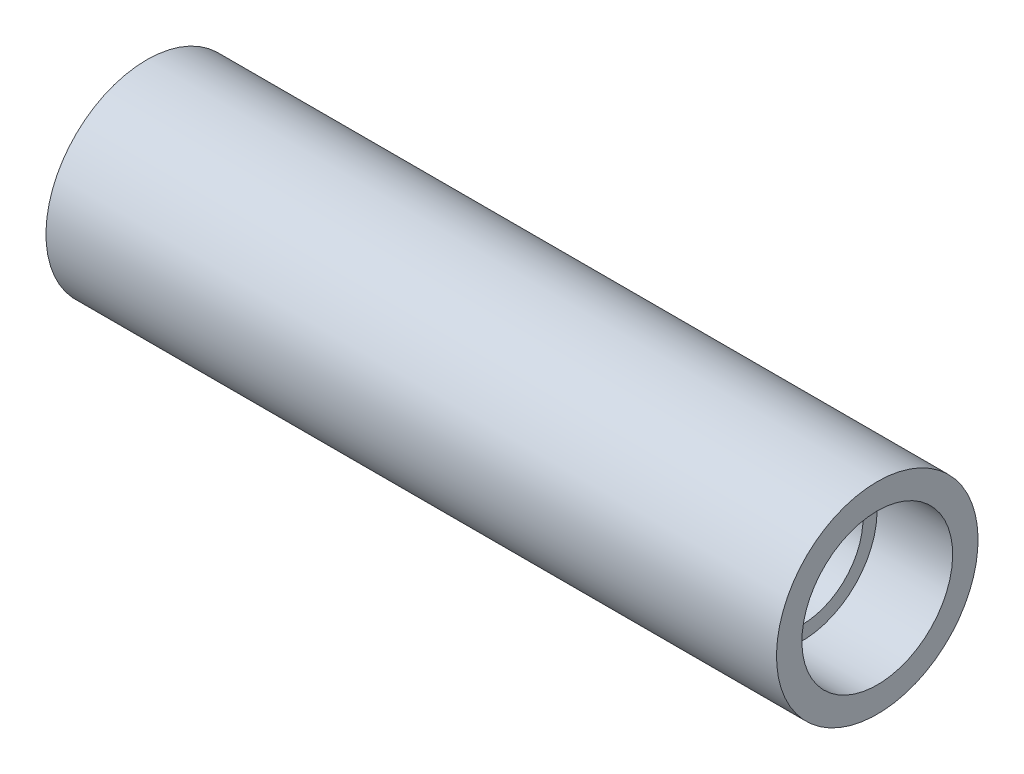
from build123d import *

# Parameters (mm, degrees)
F_24_0_152_DIAMETER_HOLE1_D = 3.8608


with BuildPart() as part:
    # Sketch1 → Revolve1 (revolve)
    with BuildSketch(Plane.XY, mode=Mode.PRIVATE) as revolve1_sk:
        Polygon((0, 0), (23.01875, 0), (23.01875, 0.8001), (20.6375, 0.8001), (20.6375, 3.175), (2.38125, 3.175), (2.38125, 0.8001), (0, 0.8001), align=None)
    revolve(revolve1_sk.sketch.rotate(Axis((1.613187702, 3.175, 0), (-1, 0, 0)), 180), axis=Axis((1.613187702, 3.175, 0), (-1, 0, 0)))

    # #24 (0.152) Diameter Hole1 (through all)
    with Locations(Plane.ZY.offset(-2.38125)):
        with Locations((0, 3.175)):
            Hole(F_24_0_152_DIAMETER_HOLE1_D / 2)


solid = part.part
